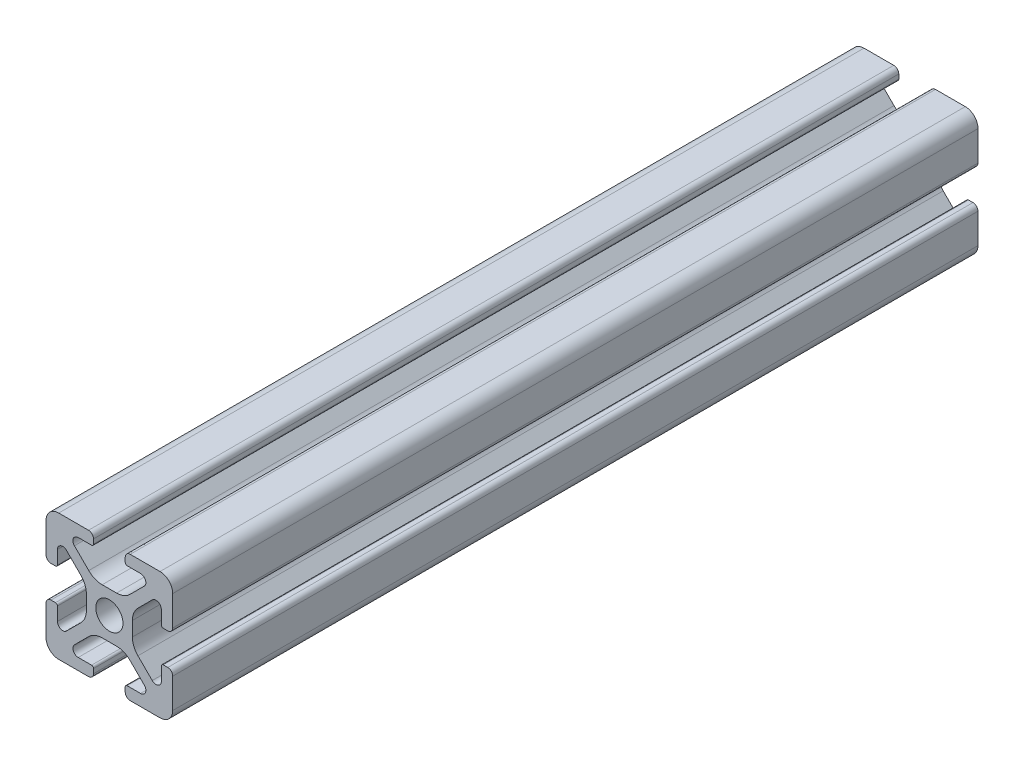
from build123d import *

# Parameters (mm, degrees)
SKETCH1_R           = 2.1463
BOSS_EXTRUDE1_DEPTH = 63.49875


with BuildPart() as part:
    # Sketch1 → Boss-Extrude1 (new, symmetric)
    with BuildSketch(Plane.XY):
        with BuildLine():
            Line((-9.9949, 7.9883), (-9.9949, 3.2893))
            ThreePointArc((-9.9949, 3.2893), (-9.76427588, 2.73252412), (-9.2075, 2.5019))
            Line((-9.2075, 2.5019), (-8.4963, 2.5019))
            ThreePointArc((-8.4963, 2.5019), (-8.280773853, 2.591173853), (-8.1915, 2.8067))
            Line((-8.1915, 2.8067), (-8.1915, 4.9149))
            ThreePointArc((-8.1915, 4.9149), (-7.674065253, 5.689295824), (-6.760603096, 5.507596904))
            Line((-6.760603096, 5.507596904), (-4.505765747, 3.252759555))
            ThreePointArc((-4.505765747, 3.252759555), (-3.856054457, 2.280397894), (-3.627906192, 1.133419111))
            Line((-3.627906192, 1.133419111), (-3.627906192, -1.133419111))
            ThreePointArc((-3.627906192, -1.133419111), (-3.856054457, -2.280397894), (-4.505765747, -3.252759555))
            Line((-4.505765747, -3.252759555), (-6.760603096, -5.507596904))
            ThreePointArc((-6.760603096, -5.507596904), (-7.674065253, -5.689295824), (-8.1915, -4.9149))
            Line((-8.1915, -4.9149), (-8.1915, -2.8067))
            ThreePointArc((-8.1915, -2.8067), (-8.280773853, -2.591173853), (-8.4963, -2.5019))
            Line((-8.4963, -2.5019), (-9.2075, -2.5019))
            ThreePointArc((-9.2075, -2.5019), (-9.76427588, -2.73252412), (-9.9949, -3.2893))
            Line((-9.9949, -3.2893), (-9.9949, -7.9883))
            ThreePointArc((-9.9949, -7.9883), (-9.407180467, -9.407180467), (-7.9883, -9.9949))
            Line((-7.9883, -9.9949), (-3.2893, -9.9949))
            ThreePointArc((-3.2893, -9.9949), (-2.73252412, -9.76427588), (-2.5019, -9.2075))
            Line((-2.5019, -9.2075), (-2.5019, -8.4963))
            ThreePointArc((-2.5019, -8.4963), (-2.591173853, -8.280773853), (-2.8067, -8.1915))
            Line((-2.8067, -8.1915), (-4.9149, -8.1915))
            ThreePointArc((-4.9149, -8.1915), (-5.689295824, -7.674065253), (-5.507596904, -6.760603096))
            Line((-5.507596904, -6.760603096), (-3.252759555, -4.505765747))
            ThreePointArc((-3.252759555, -4.505765747), (-2.280397894, -3.856054457), (-1.133419111, -3.627906192))
            Line((-1.133419111, -3.627906192), (1.133419111, -3.627906192))
            ThreePointArc((1.133419111, -3.627906192), (2.280397894, -3.856054457), (3.252759555, -4.505765747))
            Line((3.252759555, -4.505765747), (5.507596904, -6.760603096))
            ThreePointArc((5.507596904, -6.760603096), (5.689295824, -7.674065253), (4.9149, -8.1915))
            Line((4.9149, -8.1915), (2.8067, -8.1915))
            ThreePointArc((2.8067, -8.1915), (2.591173853, -8.280773853), (2.5019, -8.4963))
            Line((2.5019, -8.4963), (2.5019, -9.2075))
            ThreePointArc((2.5019, -9.2075), (2.73252412, -9.76427588), (3.2893, -9.9949))
            Line((3.2893, -9.9949), (7.9883, -9.9949))
            ThreePointArc((7.9883, -9.9949), (9.407180467, -9.407180467), (9.9949, -7.9883))
            Line((9.9949, -7.9883), (9.9949, -3.2893))
            ThreePointArc((9.9949, -3.2893), (9.76427588, -2.73252412), (9.2075, -2.5019))
            Line((9.2075, -2.5019), (8.4963, -2.5019))
            ThreePointArc((8.4963, -2.5019), (8.280773853, -2.591173853), (8.1915, -2.8067))
            Line((8.1915, -2.8067), (8.1915, -4.9149))
            ThreePointArc((8.1915, -4.9149), (7.674065253, -5.689295824), (6.760603096, -5.507596904))
            Line((6.760603096, -5.507596904), (4.505765747, -3.252759555))
            ThreePointArc((4.505765747, -3.252759555), (3.856054457, -2.280397894), (3.627906192, -1.133419111))
            Line((3.627906192, -1.133419111), (3.627906192, 1.133419111))
            ThreePointArc((3.627906192, 1.133419111), (3.856054457, 2.280397894), (4.505765747, 3.252759555))
            Line((4.505765747, 3.252759555), (6.760603096, 5.507596904))
            ThreePointArc((6.760603096, 5.507596904), (7.674065253, 5.689295824), (8.1915, 4.9149))
            Line((8.1915, 4.9149), (8.1915, 2.8067))
            ThreePointArc((8.1915, 2.8067), (8.280773853, 2.591173853), (8.4963, 2.5019))
            Line((8.4963, 2.5019), (9.2075, 2.5019))
            ThreePointArc((9.2075, 2.5019), (9.76427588, 2.73252412), (9.9949, 3.2893))
            Line((9.9949, 3.2893), (9.9949, 7.9883))
            ThreePointArc((9.9949, 7.9883), (9.407180467, 9.407180467), (7.9883, 9.9949))
            Line((7.9883, 9.9949), (3.2893, 9.9949))
            ThreePointArc((3.2893, 9.9949), (2.73252412, 9.76427588), (2.5019, 9.2075))
            Line((2.5019, 9.2075), (2.5019, 8.4963))
            ThreePointArc((2.5019, 8.4963), (2.591173853, 8.280773853), (2.8067, 8.1915))
            Line((2.8067, 8.1915), (4.9149, 8.1915))
            ThreePointArc((4.9149, 8.1915), (5.689295824, 7.674065253), (5.507596904, 6.760603096))
            Line((5.507596904, 6.760603096), (3.252759555, 4.505765747))
            ThreePointArc((3.252759555, 4.505765747), (2.280397894, 3.856054457), (1.133419111, 3.627906192))
            Line((1.133419111, 3.627906192), (-1.133419111, 3.627906192))
            ThreePointArc((-1.133419111, 3.627906192), (-2.280397894, 3.856054457), (-3.252759555, 4.505765747))
            Line((-3.252759555, 4.505765747), (-5.507596904, 6.760603096))
            ThreePointArc((-5.507596904, 6.760603096), (-5.689295824, 7.674065253), (-4.9149, 8.1915))
            Line((-4.9149, 8.1915), (-2.8067, 8.1915))
            ThreePointArc((-2.8067, 8.1915), (-2.591173853, 8.280773853), (-2.5019, 8.4963))
            Line((-2.5019, 8.4963), (-2.5019, 9.2075))
            ThreePointArc((-2.5019, 9.2075), (-2.73252412, 9.76427588), (-3.2893, 9.9949))
            Line((-3.2893, 9.9949), (-7.9883, 9.9949))
            ThreePointArc((-7.9883, 9.9949), (-9.407180467, 9.407180467), (-9.9949, 7.9883))
        make_face()
        Circle(SKETCH1_R, mode=Mode.SUBTRACT)
    extrude(amount=BOSS_EXTRUDE1_DEPTH, both=True)


solid = part.part
